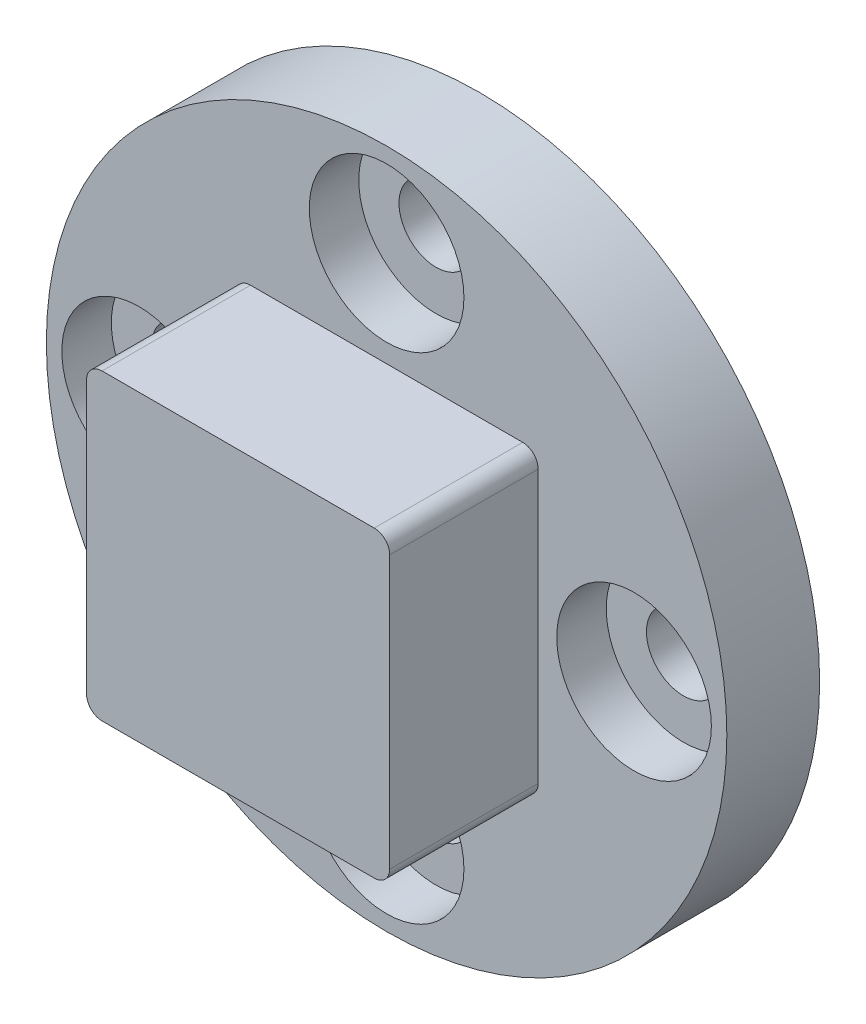
from build123d import *

# Parameters (mm, degrees)
SZKIC1_R                                          = 11
DODANIE_WYCI_GNI_CIE1_DEPTH                       = 3
POG_BIENIE_WALCOWE_POD_M2_RUB_Z_BEM_S_D           = 2.4
POG_BIENIE_WALCOWE_POD_M2_RUB_Z_BEM_S_CBORE_D     = 5
POG_BIENIE_WALCOWE_POD_M2_RUB_Z_BEM_S_CBORE_DEPTH = 1.6
SZKIC4_W                                          = 9.8
SZKIC4_H                                          = 9.8
DODANIE_WYCI_GNI_CIE2_DEPTH                       = 4.8
ZAOKR_GLENIE1_R                                   = 0.5


with BuildPart() as part:
    # Szkic1 → Dodanie-wyciągnięcie1 (new body)
    with BuildSketch(Plane.XY):
        Circle(SZKIC1_R)
    extrude(amount=DODANIE_WYCI_GNI_CIE1_DEPTH)

    # Pogłębienie walcowe pod M2 Śrubę z łbem stożkowym ściętym1 (through all)
    with Locations(Plane.XY.offset(3)):
        with Locations((-8, 0), (0, 8), (0, -8), (8, 0)):
            CounterBoreHole(POG_BIENIE_WALCOWE_POD_M2_RUB_Z_BEM_S_D / 2, POG_BIENIE_WALCOWE_POD_M2_RUB_Z_BEM_S_CBORE_D / 2, POG_BIENIE_WALCOWE_POD_M2_RUB_Z_BEM_S_CBORE_DEPTH)

    # Szkic4 → Dodanie-wyciągnięcie2 (add)
    with BuildSketch(Plane.XY.offset(3)):
        Rectangle(SZKIC4_W, SZKIC4_H)
    extrude(amount=DODANIE_WYCI_GNI_CIE2_DEPTH)

    # Zaokrąglenie1
    zaokr_glenie1_edges = [part.edges().sort_by_distance(p)[0] for p in [
        (4.9, -4.9, 5.4),
        (4.9, 4.9, 5.4),
        (-4.9, 4.9, 5.4),
        (-4.9, -4.9, 5.4),
    ]]
    fillet(zaokr_glenie1_edges, radius=ZAOKR_GLENIE1_R)


solid = part.part
